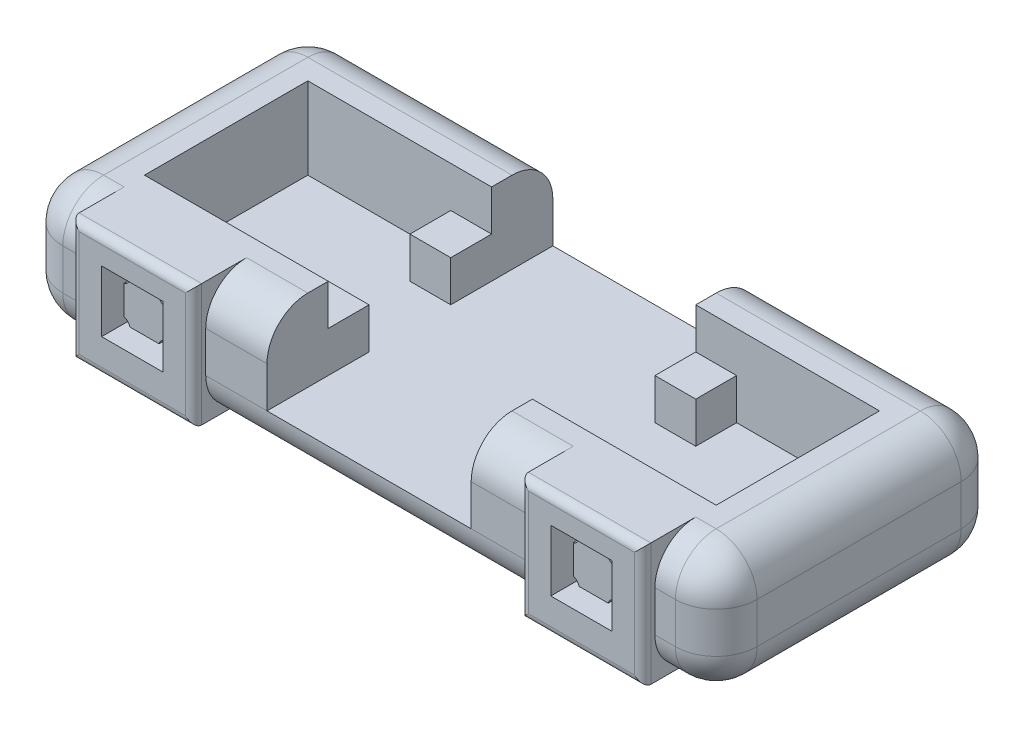
from build123d import *

# Parameters (mm, degrees)
SKETCH1_W               = 170
SKETCH1_H               = 70
BOSS_EXTRUDE1_DEPTH     = 30
FILLET1_R               = 10
SKETCH2_W               = 45
SKETCH2_H               = 40
SKETCH2_W_2             = 50
SKETCH2_H_2             = 10
SKETCH2_H_3             = 5
CUT_EXTRUDE1_DEPTH      = 20
SKETCH3_W               = 10
SKETCH3_H               = 10
BOSS_EXTRUDE2_DEPTH     = 10
SKETCH4_W               = 30
SKETCH4_H               = 10
BOSS_EXTRUDE3_DEPTH     = 3
SKETCH5_W               = 30
SKETCH5_H               = 30
BOSS_EXTRUDE4_DEPTH     = 10
FILLET2_R               = 2
SKETCH6_W               = 15
SKETCH6_H               = 15
CUT_EXTRUDE2_DEPTH      = 10
SKETCH7_W               = 10
SKETCH7_H               = 10
BOSS_EXTRUDE5_DEPTH     = 7
CUT_EXTRUDE3_DEPTH      = 7
CUT_EXTRUDE3_DEPTH_BACK = 13
SKETCH8_R               = 2
SKETCH9_W               = 60
SKETCH9_H               = 70
CUT_EXTRUDE4_DEPTH      = 2


with BuildPart() as part:
    # Sketch1 → Boss-Extrude1 (new body)
    with BuildSketch(Plane(origin=(0, 0, 0), x_dir=(1, 0, 0), z_dir=(0, 1, 0))):
        Rectangle(SKETCH1_W, SKETCH1_H)
    extrude(amount=BOSS_EXTRUDE1_DEPTH)

    # Fillet1
    fillet1_edges = [part.edges().sort_by_distance(p)[0] for p in [
        (-85, 30, 0),
        (0, 30, 35),
        (85, 30, 0),
        (0, 0, 35),
        (-85, 0, 0),
        (0, 0, -35),
        (85, 0, 0),
        (85, 15, 35),
        (-85, 15, 35),
        (-85, 15, -35),
        (85, 15, -35),
        (0, 30, -35),
    ]]
    fillet(fillet1_edges, radius=FILLET1_R)

    # Sketch2 → Cut-Extrude1 (cut)
    with BuildSketch(Plane(origin=(0, 30, 0), x_dir=(1, 0, 0), z_dir=(0, 1, 0))):
        with Locations((-47.5, 0)):
            Rectangle(SKETCH2_W, SKETCH2_H)
        Rectangle(SKETCH2_W_2, SKETCH2_H)
        with Locations((47.5, 0)):
            Rectangle(SKETCH2_W, SKETCH2_H)
        with Locations((0, 30)):
            Rectangle(SKETCH2_W_2, SKETCH2_H_2)
        with Locations((0, 22.5)):
            Rectangle(SKETCH2_W_2, SKETCH2_H_3)
        with Locations((0, -30)):
            Rectangle(SKETCH2_W_2, SKETCH2_H_2)
        with Locations((0, -22.5)):
            Rectangle(SKETCH2_W_2, SKETCH2_H_3)
    extrude(amount=-CUT_EXTRUDE1_DEPTH, mode=Mode.SUBTRACT)

    # Sketch3 → Boss-Extrude2 (add)
    with BuildSketch(Plane(origin=(0, 10, 0), x_dir=(1, 0, 0), z_dir=(0, 1, 0))):
        with Locations((-30, 15)):
            Rectangle(SKETCH3_W, SKETCH3_H)
        with Locations((30, 15)):
            Rectangle(SKETCH3_W, SKETCH3_H)
        with Locations((30, -15)):
            Rectangle(SKETCH3_W, SKETCH3_H)
        with Locations((-30, -15)):
            Rectangle(SKETCH3_W, SKETCH3_H)
    extrude(amount=BOSS_EXTRUDE2_DEPTH)

    # Sketch4 → Boss-Extrude3 (add)
    with BuildSketch(Plane.XY.offset(35)):
        Polygon((-40, 30), (-68.080792204, 30), (-70, 30), (-70, 0), (-40, 0), align=None)
        with Locations((55, 15)):
            Rectangle(SKETCH4_W, SKETCH4_H)
        with Locations((55, 25)):
            Rectangle(SKETCH4_W, SKETCH4_H)
        with Locations((55, 5)):
            Rectangle(SKETCH4_W, SKETCH4_H)
    extrude(amount=BOSS_EXTRUDE3_DEPTH)

    # Sketch5 → Boss-Extrude4 (add)
    with BuildSketch(Plane(origin=(0, 0, 35), x_dir=(-1, 0, 0), z_dir=(0, 0, -1))):
        with Locations((-55, 15)):
            Rectangle(SKETCH5_W, SKETCH5_H)
        with Locations((55, 15)):
            Rectangle(SKETCH5_W, SKETCH5_H)
    extrude(amount=BOSS_EXTRUDE4_DEPTH)

    # Fillet2
    fillet2_edges = [part.edges().sort_by_distance(p)[0] for p in [
        (-70, 15, 38),
        (-55, 0, 38),
        (-40, 15, 38),
        (-55, 30, 38),
        (40, 15, 38),
        (55, 30, 38),
        (55, 0, 38),
        (70, 15, 38),
    ]]
    fillet(fillet2_edges, radius=FILLET2_R)

    # Sketch6 → Cut-Extrude2 (cut)
    with BuildSketch(Plane.XY.offset(38)):
        with Locations((-55, 16)):
            Rectangle(SKETCH6_W, SKETCH6_H)
        with Locations((55, 16)):
            Rectangle(SKETCH6_W, SKETCH6_H)
    extrude(amount=-CUT_EXTRUDE2_DEPTH, mode=Mode.SUBTRACT)

    # Sketch7 → Boss-Extrude5 (add)
    with BuildSketch(Plane.XY.offset(28)):
        with Locations((-55, 16)):
            Rectangle(SKETCH7_W, SKETCH7_H)
        with Locations((55, 16)):
            Rectangle(SKETCH7_W, SKETCH7_H)
    extrude(amount=BOSS_EXTRUDE5_DEPTH)

    # Sketch8 → Cut-Extrude3 (cut, two sides: drawn at the far end of the back side and taken through both)
    with BuildSketch(Plane.XY.offset(28).offset(-CUT_EXTRUDE3_DEPTH_BACK)):
        with Locations(Location((49.5, 21.5, 0), (0, 0, 180))):
            Circle(SKETCH8_R)
        with Locations(Location((49.5, 10.5, 0), (0, 0, 180))):
            Circle(SKETCH8_R)
        with Locations(Location((60.5, 21.5, 0), (0, 0, 180))):
            Circle(SKETCH8_R)
        with Locations(Location((60.5, 10.5, 0), (0, 0, 194.477512186))):
            Circle(SKETCH8_R)
        with Locations(Location((-60.5, 10.5, 0), (0, 0, 180))):
            Circle(SKETCH8_R)
        with Locations(Location((-49.5, 10.5, 0), (0, 0, 165.522487814))):
            Circle(SKETCH8_R)
        with Locations(Location((-60.5, 21.5, 0), (0, 0, 180))):
            Circle(SKETCH8_R)
        with Locations(Location((-49.5, 21.5, 0), (0, 0, 180))):
            Circle(SKETCH8_R)
    extrude(amount=CUT_EXTRUDE3_DEPTH + CUT_EXTRUDE3_DEPTH_BACK, mode=Mode.SUBTRACT)

    # Sketch9 → Cut-Extrude4 (cut)
    with BuildSketch(Plane.XZ):
        Rectangle(SKETCH9_W, SKETCH9_H)
    extrude(amount=-CUT_EXTRUDE4_DEPTH, mode=Mode.SUBTRACT)


solid = part.part
